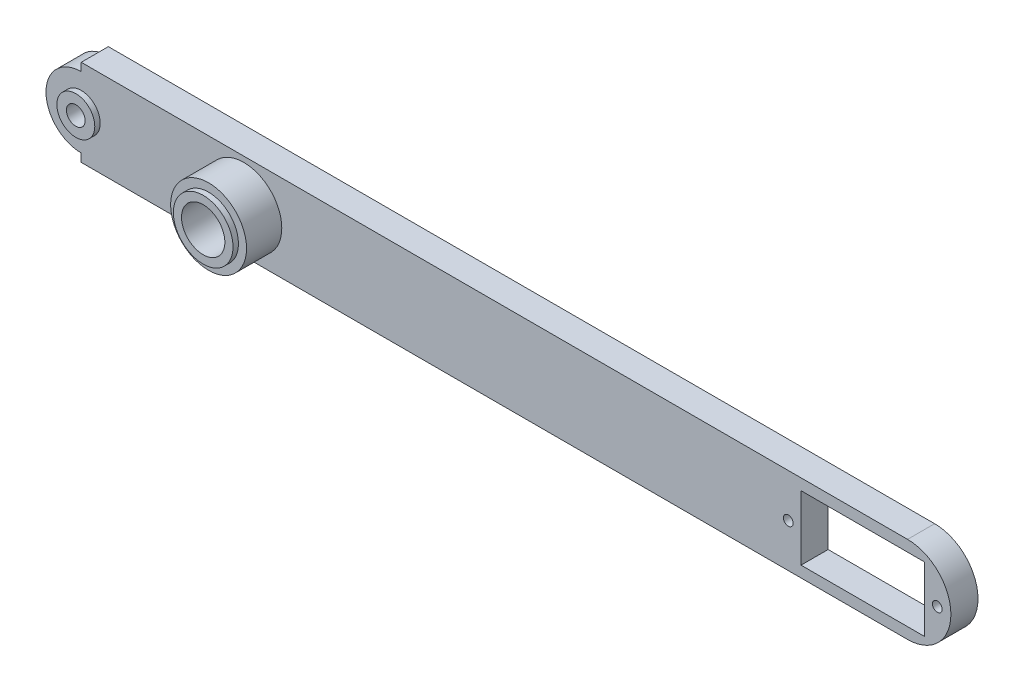
from build123d import *

# Parameters (mm, degrees)
BOSS_EXTRUDE1_START     = -9
SKETCH1_W               = 152.45
SKETCH1_H               = 16
BOSS_EXTRUDE1_DEPTH     = 5
BOSS_EXTRUDE2_START     = -9
SKETCH2_R               = 6.5
BOSS_EXTRUDE2_DEPTH     = 5
BOSS_EXTRUDE3_START     = -9
SKETCH3_R               = 8
BOSS_EXTRUDE3_DEPTH     = 5
BOSS_EXTRUDE4_START     = -9
SKETCH4_R               = 7
BOSS_EXTRUDE4_DEPTH     = 11.5
BOSS_EXTRUDE5_START     = 2.5
SKETCH5_R               = 5.5
BOSS_EXTRUDE5_DEPTH     = 1
BOSS_EXTRUDE6_START     = -4
SKETCH6_R               = 3.5
BOSS_EXTRUDE6_DEPTH     = 1
CUT_EXTRUDE1_DEPTH      = 132.004589614
CUT_EXTRUDE1_DEPTH_BACK = 132.004589614
SKETCH7_R               = 4
CUT_EXTRUDE2_DEPTH      = 132.004589614
CUT_EXTRUDE2_DEPTH_BACK = 132.004589614
SKETCH8_R               = 1.725
CUT_EXTRUDE3_DEPTH      = 132.004589614
CUT_EXTRUDE3_DEPTH_BACK = 132.004589614
SKETCH9_W               = 22.8
SKETCH9_H               = 11.9
CUT_EXTRUDE4_DEPTH      = 132.004589614
CUT_EXTRUDE4_DEPTH_BACK = 132.004589614
SKETCH10_R              = 0.9


with BuildPart() as part:
    # Sketch1 → Boss-Extrude1 (new body)
    with BuildSketch(Plane.XY.offset(BOSS_EXTRUDE1_START)):
        with Locations((46.225, 0)):
            Rectangle(SKETCH1_W, SKETCH1_H)
    extrude(amount=BOSS_EXTRUDE1_DEPTH)

    # Sketch2 → Boss-Extrude2 (add)
    with BuildSketch(Plane.XY.offset(BOSS_EXTRUDE2_START)):
        with Locations((-30, 0)):
            Circle(SKETCH2_R)
    extrude(amount=BOSS_EXTRUDE2_DEPTH)

    # Sketch3 → Boss-Extrude3 (add)
    with BuildSketch(Plane.XY.offset(BOSS_EXTRUDE3_START)):
        with Locations((122.45, 0)):
            Circle(SKETCH3_R)
    extrude(amount=BOSS_EXTRUDE3_DEPTH)

    # Sketch4 → Boss-Extrude4 (add)
    with BuildSketch(Plane.XY.offset(BOSS_EXTRUDE4_START)):
        Circle(SKETCH4_R)
    extrude(amount=BOSS_EXTRUDE4_DEPTH)

    # Sketch5 → Boss-Extrude5 (add)
    with BuildSketch(Plane.XY.offset(BOSS_EXTRUDE5_START)):
        Circle(SKETCH5_R)
    extrude(amount=BOSS_EXTRUDE5_DEPTH)

    # Sketch6 → Boss-Extrude6 (add)
    with BuildSketch(Plane.XY.offset(BOSS_EXTRUDE6_START)):
        with Locations((-30, 0)):
            Circle(SKETCH6_R)
    extrude(amount=BOSS_EXTRUDE6_DEPTH)

    # Sketch7 → Cut-Extrude1 (cut, two sides: drawn at the far end of the back side and taken through both)
    with BuildSketch(Plane.XY.offset(-CUT_EXTRUDE1_DEPTH_BACK)):
        Circle(SKETCH7_R)
    extrude(amount=CUT_EXTRUDE1_DEPTH + CUT_EXTRUDE1_DEPTH_BACK, mode=Mode.SUBTRACT)

    # Sketch8 → Cut-Extrude2 (cut, two sides: drawn at the far end of the back side and taken through both)
    with BuildSketch(Plane.XY.offset(-CUT_EXTRUDE2_DEPTH_BACK)):
        with Locations((-30, 0)):
            Circle(SKETCH8_R)
    extrude(amount=CUT_EXTRUDE2_DEPTH + CUT_EXTRUDE2_DEPTH_BACK, mode=Mode.SUBTRACT)

    # Sketch9 → Cut-Extrude3 (cut, two sides: drawn at the far end of the back side and taken through both)
    with BuildSketch(Plane.XY.offset(-CUT_EXTRUDE3_DEPTH_BACK)):
        with Locations((114.2, 0)):
            Rectangle(SKETCH9_W, SKETCH9_H)
    extrude(amount=CUT_EXTRUDE3_DEPTH + CUT_EXTRUDE3_DEPTH_BACK, mode=Mode.SUBTRACT)

    # Sketch10 → Cut-Extrude4 (cut, two sides: drawn at the far end of the back side and taken through both)
    with BuildSketch(Plane.XY.offset(-CUT_EXTRUDE4_DEPTH_BACK)):
        with Locations((100.45, 0)):
            Circle(SKETCH10_R)
        with Locations((127.95, 0)):
            Circle(SKETCH10_R)
    extrude(amount=CUT_EXTRUDE4_DEPTH + CUT_EXTRUDE4_DEPTH_BACK, mode=Mode.SUBTRACT)


solid = part.part
